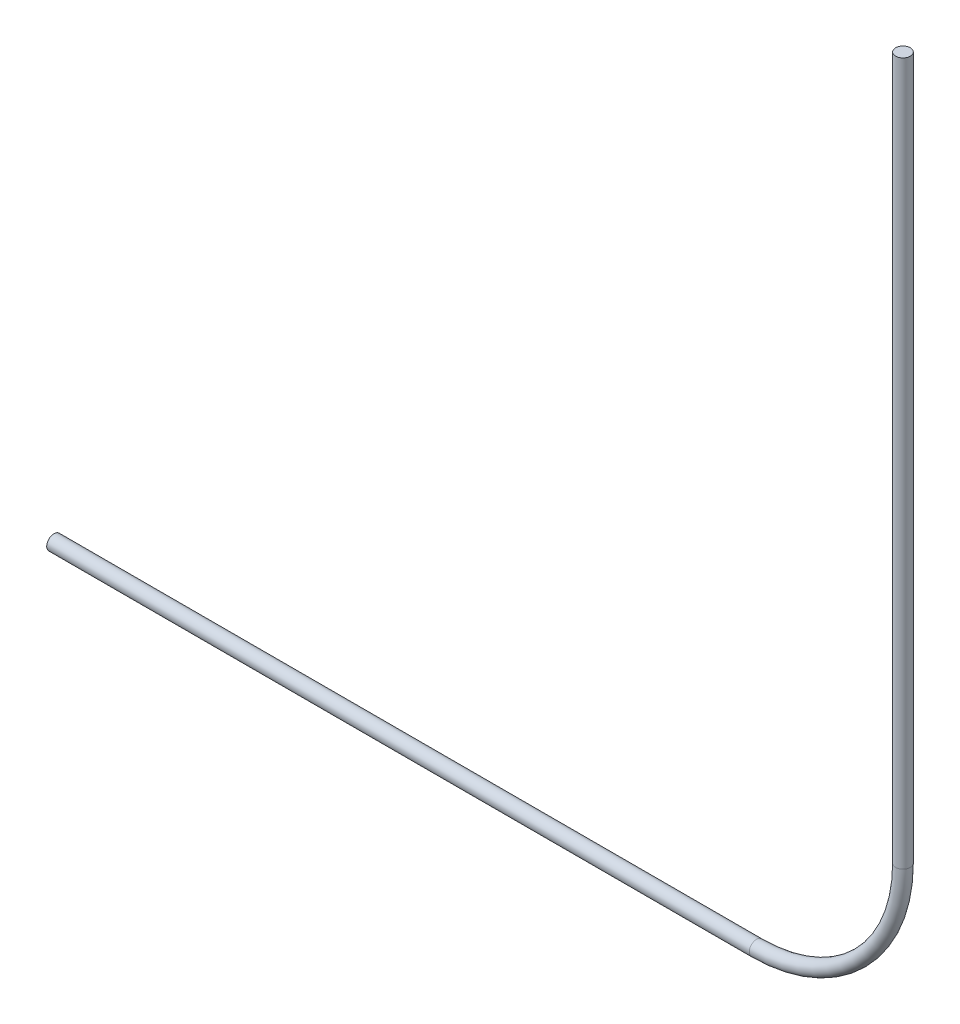
from build123d import *

# Parameters (mm, degrees)
SWEEP1_PROFILE_R = 6.35


with BuildPart() as part:
    # Sweep1: sweep along a path in Sketch1
    with BuildLine(Plane.XY) as sweep1_path:
        Line((0, 736.6), (0, 127))
        ThreePointArc((0, 127), (-37.197438789, 37.197438789), (-127, 0))
        Line((-127, 0), (-736.6, 0))
    # Sweep1 profile (on start of the path) → Sweep1 (sweep)
    with BuildSketch(Plane(origin=(0, 736.6, 0), x_dir=(0, 0, -1), z_dir=(0, -1, 0))):
        Circle(SWEEP1_PROFILE_R)
    sweep(path=sweep1_path.line)


solid = part.part
